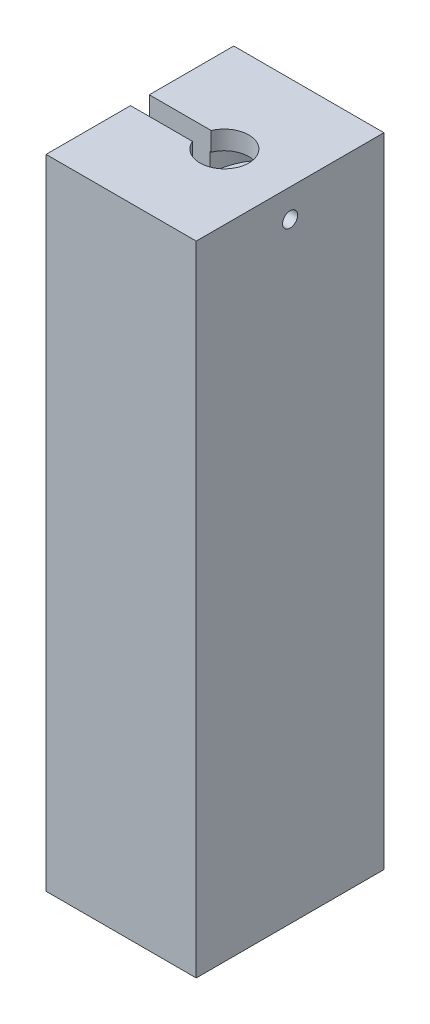
from build123d import *

# Parameters (mm, degrees)
SKETCH5_W           = 4
SKETCH5_H           = 5
BOSS_EXTRUDE3_DEPTH = 15
CUT_EXTRUDE1_DEPTH  = 16.37245914
FILLET1_R           = 0.125
SKETCH6_W           = 4
SKETCH6_H           = 5
SKETCH6_R           = 0.425
BOSS_EXTRUDE4_DEPTH = 1
SKETCH7_W           = 4
SKETCH7_H           = 5
SKETCH7_RX          = 1.3
SKETCH7_RY          = 0.65
BOSS_EXTRUDE5_DEPTH = 0.5
SKETCH9_W           = 4
SKETCH9_H           = 5
SKETCH9_R           = 0.65
BOSS_EXTRUDE6_DEPTH = 0.5
CUT_EXTRUDE2_REACH  = 19.33
SKETCH10_W          = 1.65
SKETCH10_H          = 0.5
CUT_EXTRUDE3_REACH  = 19.642
SKETCH11_R          = 0.2


with BuildPart() as part:
    # Sketch5 → Boss-Extrude3 (new body)
    with BuildSketch(Plane(origin=(0, 0, 0), x_dir=(1, 0, 0), z_dir=(0, 1, 0))):
        with Locations((-0.25, 0)):
            Rectangle(SKETCH5_W, SKETCH5_H)
    extrude(amount=BOSS_EXTRUDE3_DEPTH)

    # Sketch3 → Cut-Extrude1 (cut, through all)
    with BuildSketch(Plane(origin=(0, 0, 0), x_dir=(1, 0, 0), z_dir=(0, 1, 0))):
        with BuildLine():
            Line((-2.5, 0.9), (-2, 0.93))
            Line((-2, 0.93), (-2, 0.56))
            Line((-2, 0.56), (-1.5, 0.56))
            Line((-1.5, 0.56), (-1.5, 0.96))
            Line((-1.5, 0.96), (0, 1.05))
            ThreePointArc((0, 1.05), (1.05, 0), (0, -1.05))
            Line((0, -1.05), (-1.5, -0.96))
            Line((-1.5, -0.96), (-1.5, -0.56))
            Line((-1.5, -0.56), (-2, -0.56))
            Line((-2, -0.56), (-2, -0.93))
            Line((-2, -0.93), (-2.5, -0.9))
            Line((-2.5, -0.9), (-5, -0.9))
            ThreePointArc((-5, -0.9), (-5.9, 0), (-5, 0.9))
            Line((-5, 0.9), (-2.5, 0.9))
        make_face()
    extrude(amount=CUT_EXTRUDE1_DEPTH, mode=Mode.SUBTRACT)

    # Fillet1
    fillet1_edges = [part.edges().sort_by_distance(p)[0] for p in [
        (-1.5, 7.5, -0.56),
        (-2, 7.5, -0.56),
        (-2, 7.5, 0.56),
        (-1.5, 7.5, 0.56),
    ]]
    fillet(fillet1_edges, radius=FILLET1_R)

    # Sketch6 → Boss-Extrude4 (add)
    with BuildSketch(Plane(origin=(0, 15, 0), x_dir=(1, 0, 0), z_dir=(0, 1, 0))):
        with Locations((-0.25, 0)):
            Rectangle(SKETCH6_W, SKETCH6_H)
        with Locations(Location((0, 0, 0), (0, 0, 270))):
            Circle(SKETCH6_R, mode=Mode.SUBTRACT)
    extrude(amount=BOSS_EXTRUDE4_DEPTH)

    # Sketch7 → Boss-Extrude5 (add)
    with BuildSketch(Plane(origin=(0, 16, 0), x_dir=(1, 0, 0), z_dir=(0, 1, 0))):
        with Locations((-0.25, 0)):
            Rectangle(SKETCH7_W, SKETCH7_H)
        with Locations(Location((0, 0), (0, 0, 90))):
            Ellipse(SKETCH7_RX, SKETCH7_RY, mode=Mode.SUBTRACT)
    extrude(amount=BOSS_EXTRUDE5_DEPTH)

    # Sketch9 → Boss-Extrude6 (add)
    with BuildSketch(Plane(origin=(0, 16.5, 0), x_dir=(1, 0, 0), z_dir=(0, 1, 0))):
        with Locations((-0.25, 0)):
            Rectangle(SKETCH9_W, SKETCH9_H)
        Circle(SKETCH9_R, mode=Mode.SUBTRACT)
    extrude(amount=BOSS_EXTRUDE6_DEPTH)

    # Cut-Extrude2: up to this face of the body (flat: up to its plane)
    cut_extrude2_end = Plane(part.part.faces().sort_by_distance((0.0037652, 16, 1.270907163))[0])
    # Sketch10 → Cut-Extrude2 (cut, up to the picked face)
    with BuildSketch(Plane(origin=(0, 17, 0), x_dir=(1, 0, 0), z_dir=(0, 1, 0)), mode=Mode.PRIVATE) as cut_extrude2_sk1:
        with Locations((-1.425, 0)):
            Rectangle(SKETCH10_W, SKETCH10_H)
    cut_extrude2_tool1 = split(extrude(cut_extrude2_sk1.sketch, amount=-CUT_EXTRUDE2_REACH, mode=Mode.PRIVATE), bisect_by=cut_extrude2_end, keep=Keep.BOTH, mode=Mode.PRIVATE)
    add(cut_extrude2_tool1.solids().sort_by(Axis((-1.425, 17, 0), (0, -1, 0)))[0], mode=Mode.SUBTRACT)

    # Sketch11 → Cut-Extrude3 (cut, up to next)
    with BuildSketch(Plane(origin=(1.75, 0, 0), x_dir=(0, 0, -1), z_dir=(1, 0, 0)), mode=Mode.PRIVATE) as cut_extrude3_sk1:
        with Locations((0, 16.25)):
            Circle(SKETCH11_R)
    cut_extrude3_tool1 = extrude(cut_extrude3_sk1.sketch, amount=-CUT_EXTRUDE3_REACH, mode=Mode.PRIVATE) & part.part
    add(cut_extrude3_tool1.solids().sort_by_distance((1.75, 16.25, 0))[0], mode=Mode.SUBTRACT)


solid = part.part
